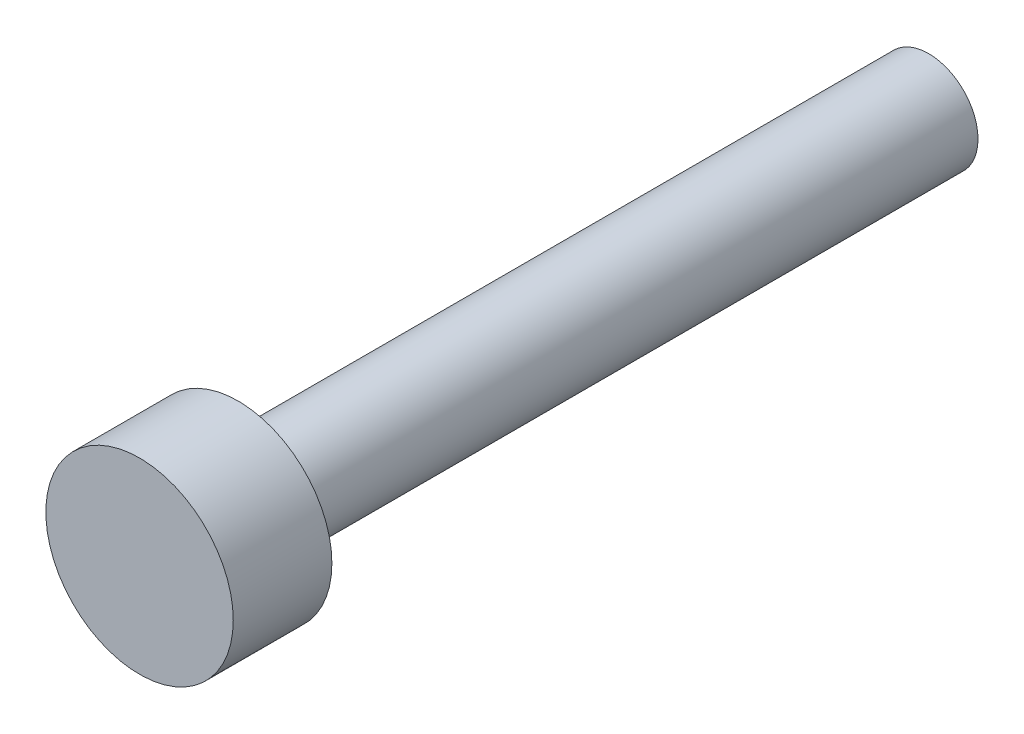
from build123d import *

# Parameters (mm, degrees)
SHANK_NOMINAL_THREAD_ENVELOPE_START     = -14
SHANK_NOMINAL_THREAD_ENVELOPE_PROFILE_R = 1
SHANK_NOMINAL_THREAD_ENVELOPE_DEPTH     = 14
SOCKET_HEAD_ENVELOPE_PROFILE_R          = 1.9
SOCKET_HEAD_ENVELOPE_DEPTH              = 2


with BuildPart() as part:
    # Shank_nominal_thread_envelope_profile → Shank_nominal_thread_envelope (new body)
    with BuildSketch(Plane.XY.offset(SHANK_NOMINAL_THREAD_ENVELOPE_START)):
        Circle(SHANK_NOMINAL_THREAD_ENVELOPE_PROFILE_R)
    extrude(amount=SHANK_NOMINAL_THREAD_ENVELOPE_DEPTH)

    # Socket_head_envelope_profile → Socket_head_envelope (add)
    with BuildSketch(Plane.XY):
        Circle(SOCKET_HEAD_ENVELOPE_PROFILE_R)
    extrude(amount=SOCKET_HEAD_ENVELOPE_DEPTH)


solid = part.part
